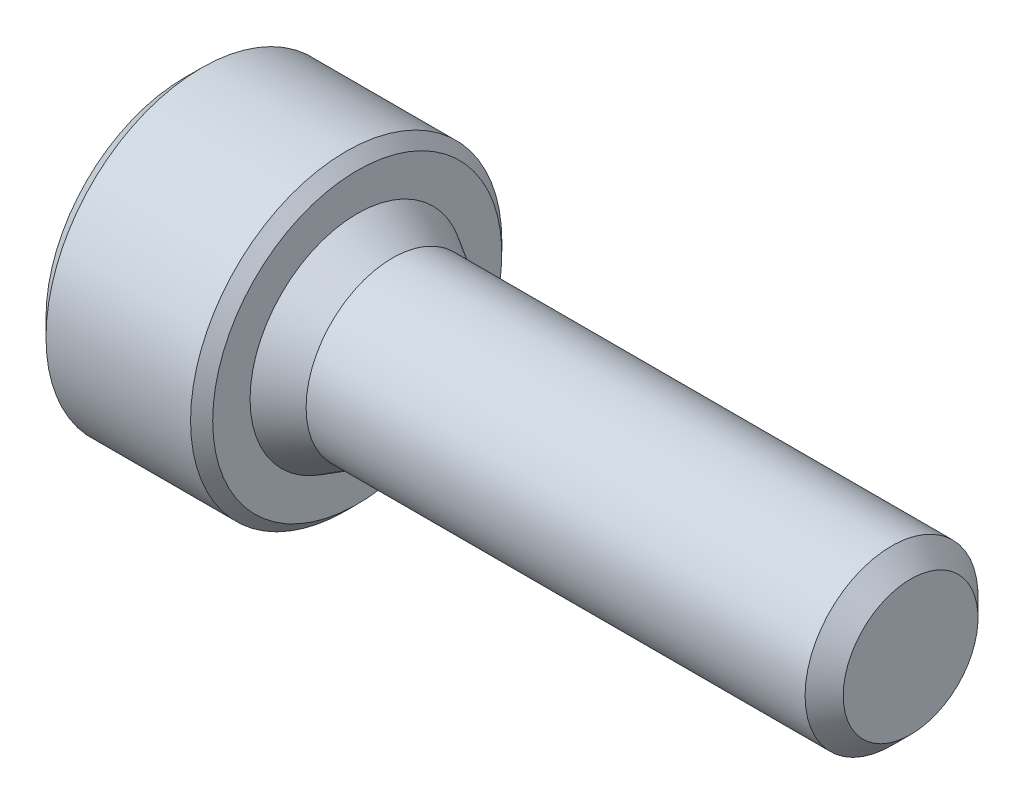
from build123d import *

# Parameters (mm, degrees)
CUT_EXTRUDE1_DEPTH      = 1.1
CUT_EXTRUDE1_DEPTH_BACK = 1.1


with BuildPart() as part:
    # Sketch1 → Revolve1 (revolve)
    with BuildSketch(Plane.XY):
        Polygon((-2.5, 0), (-2.5, 2.25), (0, 2.25), (0, 1.55), (0.51, 1.25), (7.724, 1.25), (8, 0.974), (8, 0), align=None)
    revolve(axis=Axis((8, 0, 0), (-1, 0, 0)))

    # Sketch2 → Cut-Revolve1 (revolve, cut)
    with BuildSketch(Plane.XY):
        Polygon((-2.5, 2.7), (-2.5, 2), (-2.25, 2.25), (-0.16, 2.25), (0, 2.09), (0, 2.7), align=None)
    revolve(axis=Axis((0, 0, 0), (-1, 0, 0)), mode=Mode.SUBTRACT)

    # Sketch3 → Cut-Revolve2 (revolve, cut)
    with BuildSketch(Plane.XY):
        Polygon((-2.5, 0), (-2.5, 1.14), (-2.36, 1), (-1.4, 1), (-0.822649731, 0), align=None)
    revolve(axis=Axis((-0.822649731, 0, 0), (-1, 0, 0)), mode=Mode.SUBTRACT)

    # Sketch4 → Cut-Extrude1 (cut, two sides: drawn at the far end of the back side and taken through both)
    with BuildSketch(Plane(origin=(-2.5, 0, 0), x_dir=(0, 0, -1), z_dir=(1, 0, 0)).offset(-CUT_EXTRUDE1_DEPTH_BACK)):
        Polygon((-1, -0.577350269), (0, -1.154700538), (1, -0.577350269), (1, 0.577350269), (0, 1.154700538), (-1, 0.577350269), align=None)
    extrude(amount=CUT_EXTRUDE1_DEPTH + CUT_EXTRUDE1_DEPTH_BACK, mode=Mode.SUBTRACT)


solid = part.part
